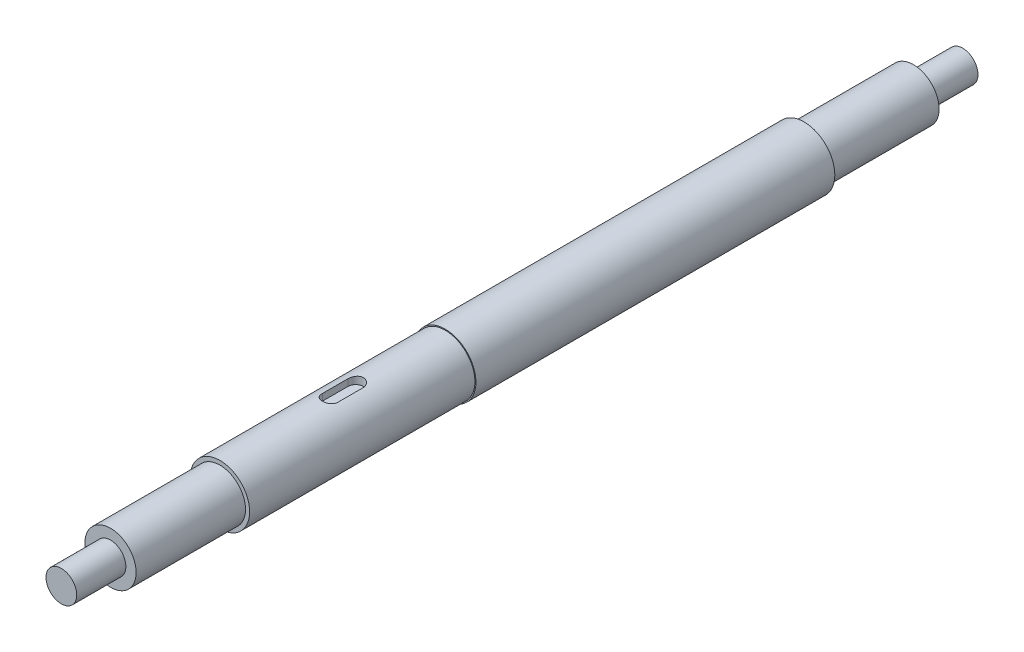
from build123d import *

# Parameters (mm, degrees)
SKETCH1_R           = 9.525
BOSS_EXTRUDE1_DEPTH = 139.7
CUT_EXTRUDE1_REACH  = 232.645
SKETCH3_R           = 9.525
SKETCH3_R_2         = 7.9375
CUT_EXTRUDE2_REACH  = 266.503
SKETCH4_R           = 7.9375
SKETCH4_R_2         = 4.7625
SKETCH5_R           = 9.525
SKETCH5_R_2         = 9.2075
CUT_EXTRUDE3_DEPTH  = 69.85
CUT_EXTRUDE4_DEPTH  = 2.38125


with BuildPart() as part:
    # Sketch1 → Boss-Extrude1 (new, symmetric)
    with BuildSketch(Plane.XY):
        Circle(SKETCH1_R)
    extrude(amount=BOSS_EXTRUDE1_DEPTH, both=True)

    # Sketch3 → Cut-Extrude1 (cut, up to next)
    with BuildSketch(Plane.XY.offset(90.551), mode=Mode.PRIVATE) as cut_extrude1_sk1:
        Circle(SKETCH3_R)
        Circle(SKETCH3_R_2, mode=Mode.SUBTRACT)
    cut_extrude1_tool1 = extrude(cut_extrude1_sk1.sketch, amount=CUT_EXTRUDE1_REACH, mode=Mode.PRIVATE) & part.part
    cut_extrude1 = cut_extrude1_tool1.solids().sort_by_distance((-9.255592, 0, 90.551))[0]
    add(cut_extrude1, mode=Mode.SUBTRACT)

    # Mirror1: Cut-Extrude1 across plane
    add(cut_extrude1.mirror(Plane.XY), mode=Mode.SUBTRACT)

    # Sketch4 → Cut-Extrude2 (cut, up to next)
    with BuildSketch(Plane.XY.offset(124.46), mode=Mode.PRIVATE) as cut_extrude2_sk1:
        Circle(SKETCH4_R)
        with Locations(Location((0, 0, 0), (0, 0, 180))):
            Circle(SKETCH4_R_2, mode=Mode.SUBTRACT)
    cut_extrude2_tool1 = extrude(cut_extrude2_sk1.sketch, amount=CUT_EXTRUDE2_REACH, mode=Mode.PRIVATE) & part.part
    cut_extrude2 = cut_extrude2_tool1.solids().sort_by_distance((-7.712994, 0, 124.46))[0]
    add(cut_extrude2, mode=Mode.SUBTRACT)

    # Mirror2: Cut-Extrude2 across plane
    add(cut_extrude2.mirror(Plane.XY), mode=Mode.SUBTRACT)

    # Sketch5 → Cut-Extrude3 (cut)
    with BuildSketch(Plane.XY.offset(90.551)):
        Circle(SKETCH5_R)
        Circle(SKETCH5_R_2, mode=Mode.SUBTRACT)
    extrude(amount=-CUT_EXTRUDE3_DEPTH, mode=Mode.SUBTRACT)

    # Sketch6 → Cut-Extrude4 (cut)
    with BuildSketch(Plane(origin=(0, 9.2075, 0), x_dir=(1, 0, 0), z_dir=(0, 1, 0))):
        with BuildLine():
            Line((2.38125, -56.41975), (2.38125, -48.48225))
            ThreePointArc((2.38125, -48.48225), (0, -46.101), (-2.38125, -48.48225))
            Line((-2.38125, -48.48225), (-2.38125, -56.41975))
            ThreePointArc((-2.38125, -56.41975), (0, -58.801), (2.38125, -56.41975))
        make_face()
    extrude(amount=-CUT_EXTRUDE4_DEPTH, mode=Mode.SUBTRACT)


solid = part.part
